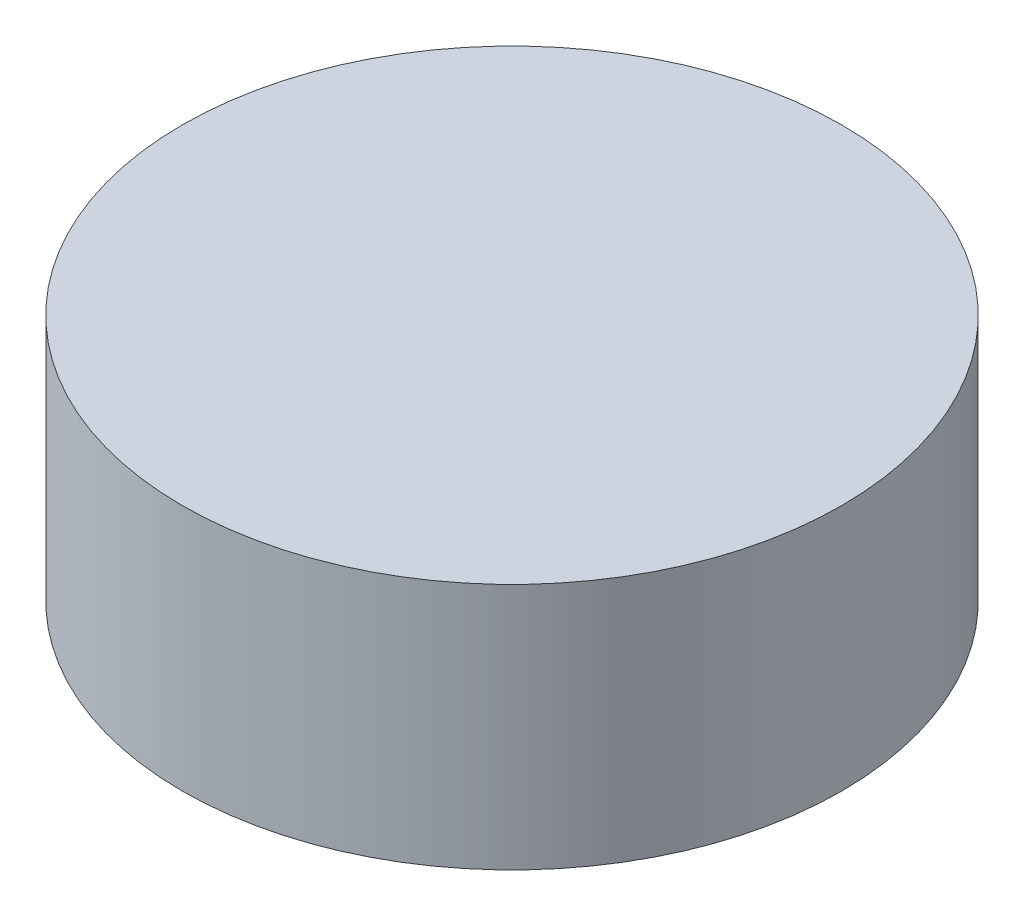
from build123d import *

# Parameters (mm, degrees)
SKETCH2_R           = 50.8
BOSS_EXTRUDE1_DEPTH = 38.1
CIRPATTERN1_COUNT   = 8
SKETCH11_W          = 17.78
SKETCH11_H          = 6.35
SKETCH11_W_2        = 31.75
SKETCH11_H_2        = 5.08


with BuildPart() as part:
    # Sketch2 → Boss-Extrude1 (new body)
    with BuildSketch(Plane(origin=(0, 0, 0), x_dir=(1, 0, 0), z_dir=(0, 1, 0))):
        with Locations(Location((0, 0, 0), (0, 0, 90))):
            Circle(SKETCH2_R)
    extrude(amount=BOSS_EXTRUDE1_DEPTH)

    # Sketch6 → Fuel (revolve, cut)
    with BuildSketch(Plane(origin=(0, 0, 28.575), x_dir=(0, 0, -1), z_dir=(1, 0, 0))):
        Polygon((0, 0), (0, 25.705237194), (0.508, 25.4), (0.508, 0), align=None)
    fuel = revolve(axis=Axis((0, -6.35, 28.575), (0, 1, 0)), mode=Mode.SUBTRACT)

    # Sketch10 → #60 (0.04) Diameter Hole2 (revolve, cut)
    with BuildSketch(Plane(origin=(-3.175, -3.175, 28.575), x_dir=(0.7071067811865464, 0.7071067811865488, 0), z_dir=(0, 0, 1))):
        Polygon((0, 0), (0, 25.705237194), (0.508, 25.4), (0.508, 0), align=None)
    f_60_0_04_diameter_hole2 = revolve(axis=Axis((1.315128061, -7.665128061, 28.575), (-0.7071067811865487, 0.7071067811865464, 0)), mode=Mode.SUBTRACT)

    # Mirror1: #60 (0.04) Diameter Hole2 across plane
    add(f_60_0_04_diameter_hole2.mirror(Plane(origin=(0, 0, 0), x_dir=(0, 0, 1), z_dir=(1, 0, 0))), mode=Mode.SUBTRACT)

    # CirPattern1: Fuel, #60 (0.04) Diameter Hole2 ×8 about axis
    cirpattern1_axis = Axis((0, 0, 0), (0, 1, 0))
    add([fuel.rotate(cirpattern1_axis, i * 360 / CIRPATTERN1_COUNT) for i in range(1, CIRPATTERN1_COUNT)], mode=Mode.SUBTRACT)
    add([f_60_0_04_diameter_hole2.rotate(cirpattern1_axis, i * 360 / CIRPATTERN1_COUNT) for i in range(1, CIRPATTERN1_COUNT)], mode=Mode.SUBTRACT)

    # CirPattern1 copy 1 sketch → CirPattern1 copy 1 (revolve, cut)
    with BuildSketch(Plane(origin=(22.450640303, -3.175, 17.960512242), x_dir=(-0.4999999999999992, 0.7071067811865488, 0.4999999999999991), z_dir=(0.7071067811865475, 0, 0.7071067811865476))):
        Polygon((0, 0), (0, -25.705237194), (0.508, -25.4), (0.508, 0), align=None)
    revolve(axis=Axis((19.275640303, -7.665128061, 21.135512242), (-0.5000000000000009, -0.7071067811865464, 0.5000000000000008)), mode=Mode.SUBTRACT)

    # CirPattern1 copy 2 sketch → CirPattern1 copy 2 (revolve, cut)
    with BuildSketch(Plane(origin=(28.575, -3.175, -3.175), x_dir=(0, 0.7071067811865488, 0.7071067811865464), z_dir=(1, 0, 0))):
        Polygon((0, 0), (0, -25.705237194), (0.508, -25.4), (0.508, 0), align=None)
    revolve(axis=Axis((28.575, -7.665128061, 1.315128061), (0, -0.7071067811865464, 0.7071067811865487)), mode=Mode.SUBTRACT)

    # CirPattern1 copy 3 sketch → CirPattern1 copy 3 (revolve, cut)
    with BuildSketch(Plane(origin=(17.960512242, -3.175, -22.450640303), x_dir=(0.4999999999999991, 0.7071067811865488, 0.4999999999999992), z_dir=(0.7071067811865476, 0, -0.7071067811865475))):
        Polygon((0, 0), (0, -25.705237194), (0.508, -25.4), (0.508, 0), align=None)
    revolve(axis=Axis((21.135512242, -7.665128061, -19.275640303), (0.5000000000000008, -0.7071067811865464, 0.5000000000000009)), mode=Mode.SUBTRACT)

    # CirPattern1 copy 4 sketch → CirPattern1 copy 4 (revolve, cut)
    with BuildSketch(Plane(origin=(-3.175, -3.175, -28.575), x_dir=(0.7071067811865464, 0.7071067811865488, 0), z_dir=(0, 0, -1))):
        Polygon((0, 0), (0, -25.705237194), (0.508, -25.4), (0.508, 0), align=None)
    revolve(axis=Axis((1.315128061, -7.665128061, -28.575), (0.7071067811865487, -0.7071067811865464, 0)), mode=Mode.SUBTRACT)

    # CirPattern1 copy 5 sketch → CirPattern1 copy 5 (revolve, cut)
    with BuildSketch(Plane(origin=(-22.450640303, -3.175, -17.960512242), x_dir=(0.4999999999999993, 0.7071067811865488, -0.4999999999999991), z_dir=(-0.7071067811865475, 0, -0.7071067811865477))):
        Polygon((0, 0), (0, -25.705237194), (0.508, -25.4), (0.508, 0), align=None)
    revolve(axis=Axis((-19.275640303, -7.665128061, -21.135512242), (0.5000000000000009, -0.7071067811865464, -0.5000000000000008)), mode=Mode.SUBTRACT)

    # CirPattern1 copy 6 sketch → CirPattern1 copy 6 (revolve, cut)
    with BuildSketch(Plane(origin=(-28.575, -3.175, 3.175), x_dir=(0, 0.7071067811865488, -0.7071067811865464), z_dir=(-1, 0, 0))):
        Polygon((0, 0), (0, -25.705237194), (0.508, -25.4), (0.508, 0), align=None)
    revolve(axis=Axis((-28.575, -7.665128061, -1.315128061), (0, -0.7071067811865464, -0.7071067811865487)), mode=Mode.SUBTRACT)

    # CirPattern1 copy 7 sketch → CirPattern1 copy 7 (revolve, cut)
    with BuildSketch(Plane(origin=(-17.960512242, -3.175, 22.450640303), x_dir=(-0.49999999999999906, 0.7071067811865488, -0.4999999999999993), z_dir=(-0.7071067811865477, 0, 0.7071067811865474))):
        Polygon((0, 0), (0, -25.705237194), (0.508, -25.4), (0.508, 0), align=None)
    revolve(axis=Axis((-21.135512242, -7.665128061, 19.275640303), (-0.5000000000000007, -0.7071067811865464, -0.5000000000000009)), mode=Mode.SUBTRACT)

    # Sketch11 → Cut-Revolve1 (revolve, cut)
    with BuildSketch(Plane(origin=(0, 0, 0), x_dir=(0, 0, -1), z_dir=(1, 0, 0)), mode=Mode.PRIVATE) as cut_revolve1_sk:
        with Locations((-40.64, 15.24)):
            Rectangle(SKETCH11_W, SKETCH11_H)
        with Locations((-15.875, 25.283278714)):
            Rectangle(SKETCH11_W_2, SKETCH11_H_2)
    revolve(cut_revolve1_sk.sketch.rotate(Axis((0, 0, 0), (0, 1, 0)), 180), axis=Axis((0, 0, 0), (0, 1, 0)), mode=Mode.SUBTRACT)


solid = part.part
